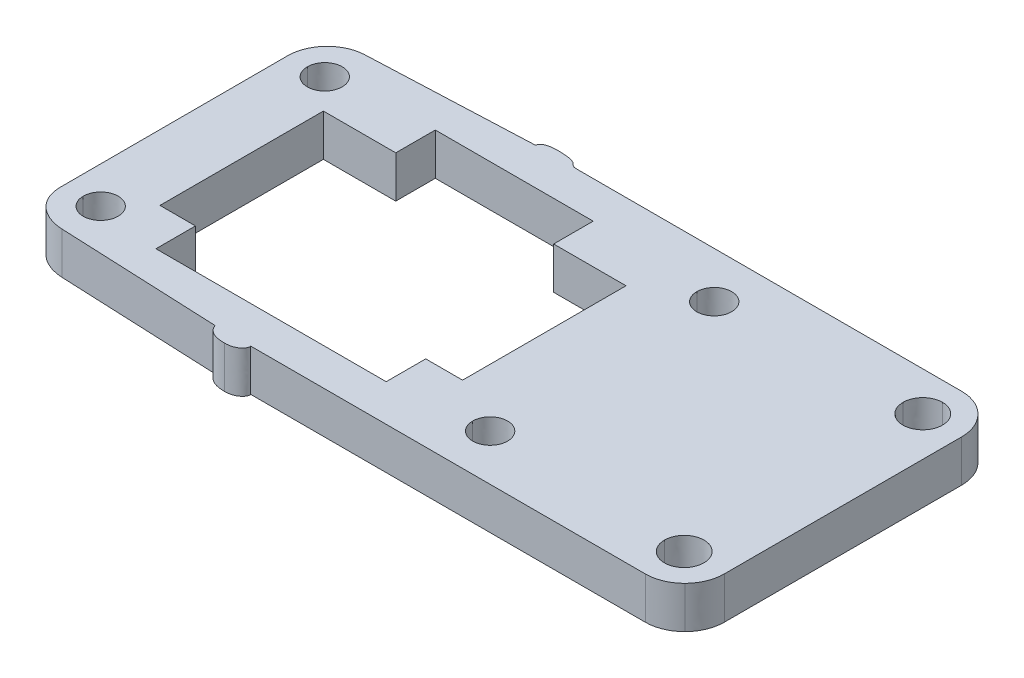
from build123d import *

# Parameters (mm, degrees)
BOSS_EXTRUDE1_DEPTH = 3.175


with BuildPart() as part:
    # Sketch1 → Boss-Extrude1 (new body)
    with BuildSketch(Plane(origin=(0, 0, 0), x_dir=(1, 0, 0), z_dir=(0, 1, 0))):
        with BuildLine():
            Line((-7.916607704, -13.568101426), (22.059516351, -13.568101426))
            add(Edge.make_bspline(
                [(22.059516351, -13.568101426), (22.853650229, -13.568101426), (23.615394255, -13.252239738), (24.176979225, -12.689642236)],
                knots=[3, 3, 3, 3, 4, 4, 4, 4], degree=3))
            add(Edge.make_bspline(
                [(24.176979225, -12.689642236), (24.738559321, -12.127044734), (25.054234873, -11.363730227), (25.054234873, -10.568216226)],
                knots=[4, 4, 4, 4, 5, 5, 5, 5], degree=3))
            Line((25.054234873, -10.568216226), (25.054234874, 7.432384125))
            add(Edge.make_bspline(
                [(25.054234874, 7.432384125), (25.054234874, 8.228152049), (24.738559322, 8.991212634), (24.176979226, 9.553810135)],
                knots=[6, 6, 6, 6, 7, 7, 7, 7], degree=3))
            add(Edge.make_bspline(
                [(24.176979226, 9.553810135), (23.615394256, 10.116476001), (22.85365023, 10.432533016), (22.059516352, 10.432533016)],
                knots=[7, 7, 7, 7, 8, 8, 8, 8], degree=3))
            add(Edge.make_bspline(
                [(22.059516352, 10.432533016), (0.930184666, 10.432533017), (-7.168277805, 10.432533017)],
                knots=[8, 8, 8, 9, 9, 9], degree=2))
            add(Edge.make_bspline(
                [(-7.168277805, 10.432533017), (-7.814831912, 10.432533017), (-7.235489796, 10.936503417), (-9.085259918, 10.936503417)],
                knots=[9, 9, 9, 9, 10, 10, 10, 10], degree=3))
            add(Edge.make_bspline(
                [(-9.085259918, 10.936503417), (-10.19538618, 10.936503417), (-10.2758222, 10.432533017)],
                knots=[10, 10, 10, 11, 11, 11], degree=2))
            Line((-10.2758222, 10.432533017), (-22.718078344, 9.900201281))
            add(Edge.make_bspline(
                [(-22.718078344, 9.900201281), (-24.308841752, 9.816738478), (-25.555955888, 8.500104453), (-25.555955888, 6.904222601)],
                knots=[12, 12, 12, 12, 13, 13, 13, 13], degree=3))
            Line((-25.555955888, 6.904222601), (-25.541956843, -10.332301472))
            add(Edge.make_bspline(
                [(-25.541956843, -10.332301472), (-25.541956843, -11.928183324), (-24.308841753, -12.952385016), (-22.718078345, -13.035847819)],
                knots=[14, 14, 14, 14, 15, 15, 15, 15], degree=3))
            Line((-22.718078345, -13.035847819), (-10.566326768, -13.568101426))
            add(Edge.make_bspline(
                [(-10.566326768, -13.568101426), (-10.566131795, -13.568101426), (-10.44372301, -14.36476785), (-9.085259919, -14.36476785)],
                knots=[0, 0, 0, 0, 1, 1, 1, 1], degree=3))
            add(Edge.make_bspline(
                [(-9.085259919, -14.36476785), (-7.973276542, -14.36476785), (-7.747619922, -13.568101426), (-7.916607704, -13.568101426)],
                knots=[1, 1, 1, 1, 2, 2, 2, 2], degree=3))
        make_face()
        Polygon((-0.350718254, -7.76802257), (-0.400743394, -7.76802257), (-0.400743394, -10.768103096), (-17.869631753, -10.768103096), (-17.869631753, -7.76802257), (-20.564779474, -7.76802257), (-20.564779474, 4.632385798), (-15.074696963, 4.632385798), (-15.074696963, 7.632466324), (-3.095696143, 7.632466324), (-3.095696143, 4.632385798), (2.394386368, 4.632385798), (2.394386368, -7.76802257), align=None, mode=Mode.SUBTRACT)
        with BuildLine():
            add(Edge.make_bspline(
                [(-21.438394006, -10.068152345), (-21.438394006, -9.336265792), (-22.030575079, -8.743197433), (-22.76101135, -8.743197433), (-23.491515862, -8.743197433), (-24.083765176, -9.336265792), (-24.083765176, -10.068152345)],
                knots=[2, 2, 2, 2, 3, 3, 3, 4, 4, 4, 4], degree=3))
            add(Edge.make_bspline(
                [(-24.083765176, -10.068152345), (-24.083765176, -10.799853338), (-23.491515862, -11.393175621), (-22.761138083, -11.393175621), (-22.030575079, -11.393175621), (-21.438394006, -10.799853339), (-21.438394006, -10.068152345)],
                knots=[0, 0, 0, 0, 1, 1, 1, 2, 2, 2, 2], degree=3))
        make_face(mode=Mode.SUBTRACT)
        with BuildLine():
            add(Edge.make_bspline(
                [(-21.438394005, 6.932378845), (-21.438394005, 7.664275164), (-22.030575078, 8.257343524), (-22.76101135, 8.257343524), (-23.491515861, 8.257343524), (-24.083765175, 7.664275165), (-24.083765175, 6.932378845)],
                knots=[2, 2, 2, 2, 3, 3, 3, 4, 4, 4, 4], degree=3))
            add(Edge.make_bspline(
                [(-24.083765175, 6.932378845), (-24.083765176, 6.200619254), (-23.491515862, 5.607365335), (-22.761138082, 5.607365335), (-22.030575078, 5.607365335), (-21.438394005, 6.200619254), (-21.438394005, 6.932378845)],
                knots=[0, 0, 0, 0, 1, 1, 1, 2, 2, 2, 2], degree=3))
        make_face(mode=Mode.SUBTRACT)
        with BuildLine():
            add(Edge.make_bspline(
                [(22.059516352, 8.982706186), (21.232412577, 8.982706186), (20.562027922, 8.310843315), (20.562027922, 7.482436415)],
                knots=[3, 3, 3, 3, 4, 4, 4, 4], degree=3))
            add(Edge.make_bspline(
                [(20.562027922, 7.482436415), (20.562027922, 6.654029515), (21.232412577, 5.98236197), (22.059321379, 5.98236197)],
                knots=[0, 0, 0, 0, 1, 1, 1, 1], degree=3))
            add(Edge.make_bspline(
                [(22.059321379, 5.98236197), (22.886235056, 5.982235008), (23.556873176, 6.654029515), (23.556873176, 7.482436415), (23.556873176, 8.310843315), (22.886235056, 8.98251086), (22.059516352, 8.982706186)],
                knots=[1, 1, 1, 1, 2, 2, 2, 3, 3, 3, 3], degree=3))
        make_face(mode=Mode.SUBTRACT)
        with BuildLine():
            add(Edge.make_bspline(
                [(23.556683077, -10.618268517), (23.556873175, -9.789666291), (22.886235055, -9.118194072), (22.059516351, -9.118194072), (21.232412576, -9.118194072), (20.562154653, -9.789666291), (20.562154653, -10.618082957)],
                knots=[2, 2, 2, 2, 3, 3, 3, 4, 4, 4, 4], degree=3))
            add(Edge.make_bspline(
                [(20.562154653, -10.618082957), (20.562154653, -11.446489857), (21.232412576, -12.118147636), (22.059321378, -12.118147636), (22.886235055, -12.118147636), (23.556683077, -11.446489858), (23.556683077, -10.618268517)],
                knots=[0, 0, 0, 0, 1, 1, 1, 2, 2, 2, 2], degree=3))
        make_face(mode=Mode.SUBTRACT)
        with BuildLine():
            add(Edge.make_bspline(
                [(8.109101892, -10.068347672), (8.109101892, -9.336451353), (7.516852578, -8.743197434), (6.786479673, -8.743197434), (6.055911795, -8.743197434), (5.463725847, -9.336451353), (5.463725847, -10.068152346)],
                knots=[2, 2, 2, 2, 3, 3, 3, 4, 4, 4, 4], degree=3))
            add(Edge.make_bspline(
                [(5.463725847, -10.068152346), (5.463725847, -10.8000389), (6.055911795, -11.393302585), (6.7862847, -11.393302585), (7.516852578, -11.393302585), (8.109101892, -10.8000389), (8.109101892, -10.068347672)],
                knots=[0, 0, 0, 0, 1, 1, 1, 2, 2, 2, 2], degree=3))
        make_face(mode=Mode.SUBTRACT)
        with BuildLine():
            add(Edge.make_bspline(
                [(8.109101892, 6.932193284), (8.109101892, 7.664079837), (7.516852578, 8.257343522), (6.786479673, 8.257343522), (6.055911795, 8.257343522), (5.463725848, 7.664079837), (5.463725848, 6.932378844)],
                knots=[2, 2, 2, 2, 3, 3, 3, 4, 4, 4, 4], degree=3))
            add(Edge.make_bspline(
                [(5.463725848, 6.932378844), (5.463725847, 6.20049229), (6.055911795, 5.607170007), (6.7862847, 5.607170007), (7.516852578, 5.607170007), (8.109101892, 6.20049229), (8.109101892, 6.932193284)],
                knots=[0, 0, 0, 0, 1, 1, 1, 2, 2, 2, 2], degree=3))
        make_face(mode=Mode.SUBTRACT)
    extrude(amount=BOSS_EXTRUDE1_DEPTH)


solid = part.part
